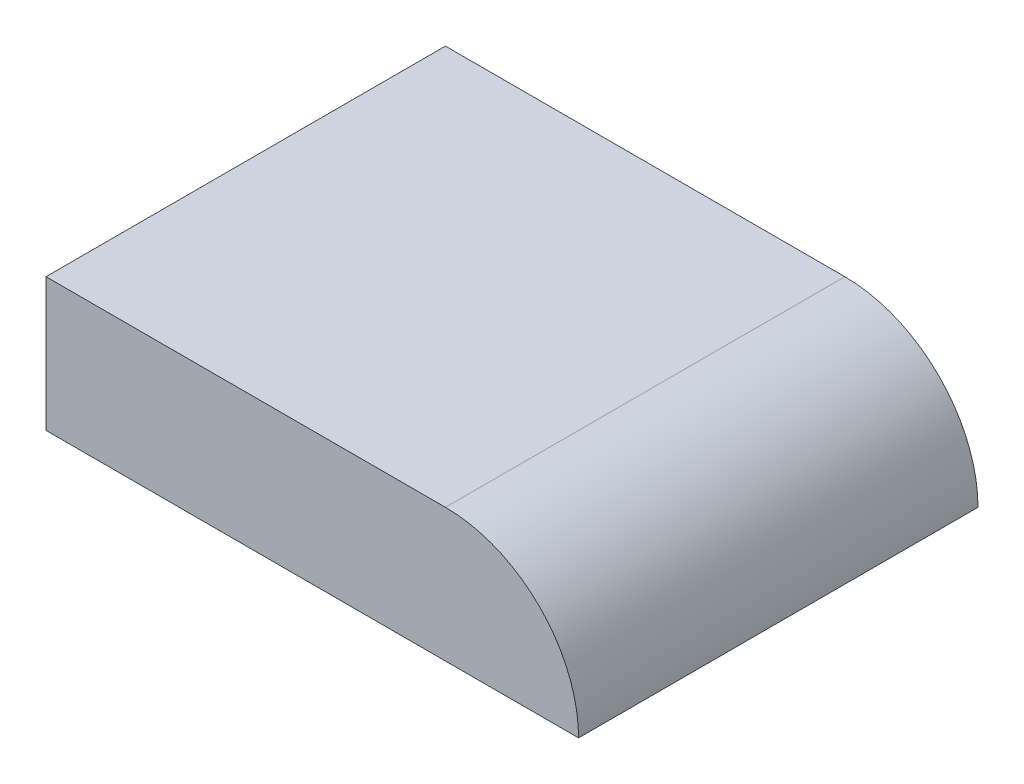
from build123d import *

# Parameters (mm, degrees)
BOSS_EXTRUDE1_DEPTH = 7.62


with BuildPart() as part:
    # Sketch1 → Boss-Extrude1 (new body)
    with BuildSketch(Plane.XY):
        with BuildLine():
            Line((-40.28417029, 44.926436108), (-30.12417029, 44.926436108))
            ThreePointArc((-30.12417029, 44.926436108), (-30.868119066, 46.722487332), (-32.66417029, 47.466436108))
            Line((-32.66417029, 47.466436108), (-40.28417029, 47.466436108))
            Line((-40.28417029, 47.466436108), (-40.28417029, 44.926436108))
        make_face()
    extrude(amount=BOSS_EXTRUDE1_DEPTH)


solid = part.part
